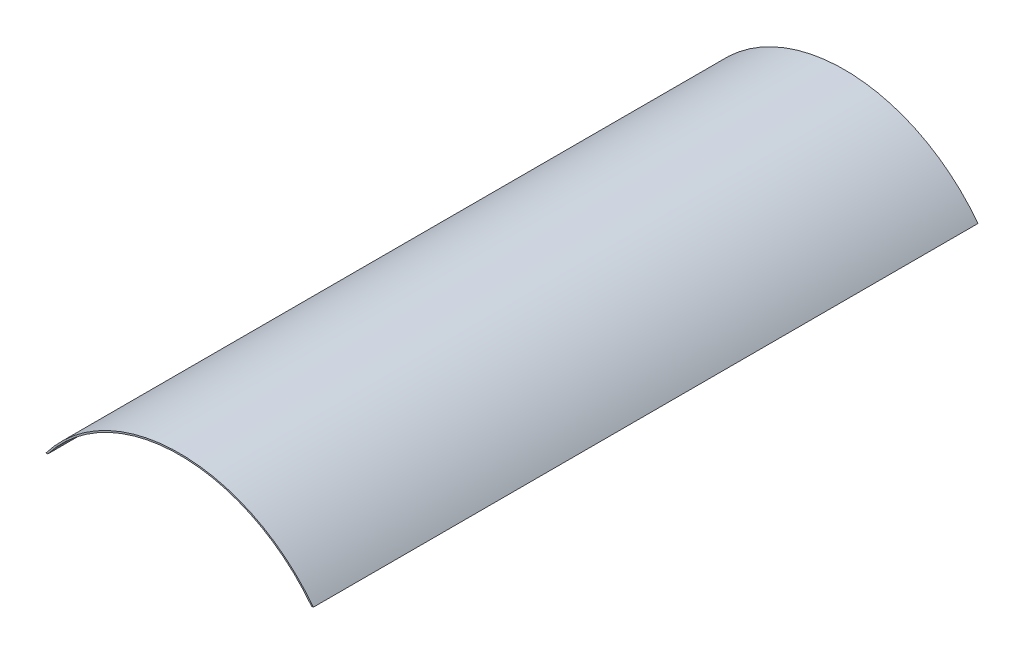
from build123d import *

# Parameters (mm, degrees)
EXTRUDE_1_DEPTH = 180


with BuildPart() as part:
    # Эскиз1 → Бобышка-Вытянуть1 (new body)
    with BuildSketch(Plane.XY):
        with BuildLine():
            Line((-35.7, 0), (-36.2, 0))
            ThreePointArc((-36.2, 0), (0, 18.002249589), (36.2, 0))
            Line((36.2, 0), (35.7, 0))
            ThreePointArc((35.7, 0), (0, 17.604562424), (-35.7, 0))
        make_face()
    extrude(amount=EXTRUDE_1_DEPTH)


solid = part.part
